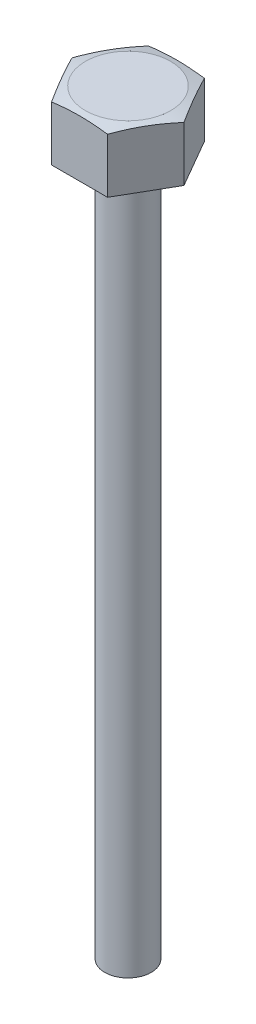
from build123d import *

# Parameters (mm, degrees)
EXTRUDE_1_DEPTH = 15
SKETCH_2_R      = 6
EXTRUDE_2_DEPTH = 180


with BuildPart() as part:
    # 草图1 → 凸台-拉伸1 (new body)
    with BuildSketch(Plane(origin=(0, 0, 0), x_dir=(1, 0, 0), z_dir=(0, 1, 0))):
        Polygon((-7.216878365, 12.5), (-14.43375673, 0), (-7.216878365, -12.5), (7.216878365, -12.5), (14.43375673, 0), (7.216878365, 12.5), align=None)
    extrude(amount=-EXTRUDE_1_DEPTH)

    # 草图2 → 凸台-拉伸2 (add)
    with BuildSketch(Plane.XZ.offset(15)):
        with Locations(Location((0, 0, 0), (0, 0, 90))):
            Circle(SKETCH_2_R)
    extrude(amount=EXTRUDE_2_DEPTH)

    # 草图9 → 切除-旋转1 (revolve, cut)
    with BuildSketch(Plane.XY, mode=Mode.PRIVATE) as cut_revolve_1_sk:
        Polygon((11, 0), (14.43375673, -0.920072343), (14.43375673, 0), align=None)
    revolve(cut_revolve_1_sk.sketch.rotate(Axis((0, -195, 0), (0, 1, 0)), 90), axis=Axis((0, -195, 0), (0, 1, 0)), mode=Mode.SUBTRACT)


solid = part.part
